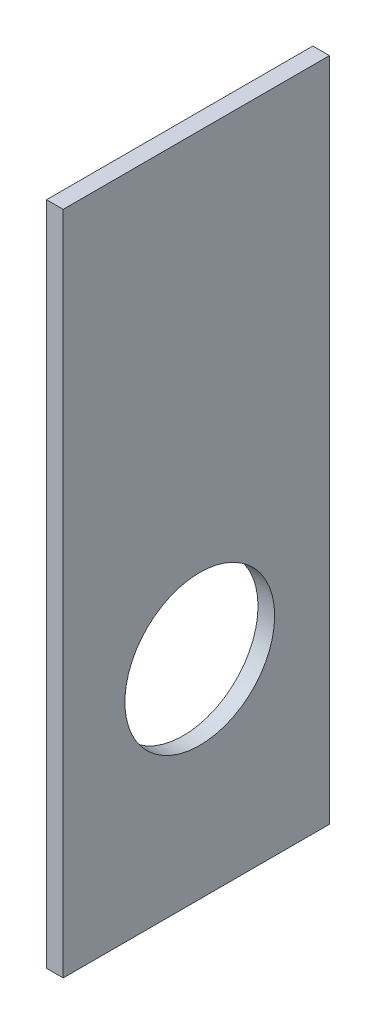
from build123d import *

# Parameters (mm, degrees)
SKETCH1_W           = 50.8
SKETCH1_H           = 127
BOSS_EXTRUDE1_DEPTH = 3.175
SKETCH2_R           = 14.2875
CUT_EXTRUDE1_DEPTH  = 9.525


with BuildPart() as part:
    # Sketch1 → Boss-Extrude1 (new body)
    with BuildSketch(Plane(origin=(0, 0, 0), x_dir=(0, 0, -1), z_dir=(1, 0, 0))):
        with Locations((25.4, 63.5)):
            Rectangle(SKETCH1_W, SKETCH1_H)
    extrude(amount=BOSS_EXTRUDE1_DEPTH)

    # Sketch2 → Cut-Extrude1 (cut)
    with BuildSketch(Plane(origin=(3.175, 0, 0), x_dir=(0, 0, -1), z_dir=(1, 0, 0))):
        with Locations((26.058423386, 39.6875)):
            Circle(SKETCH2_R)
    extrude(amount=-CUT_EXTRUDE1_DEPTH, mode=Mode.SUBTRACT)


solid = part.part
